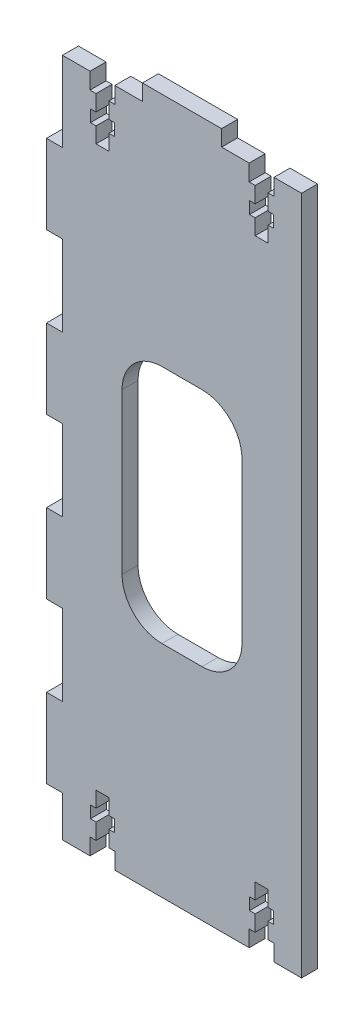
from build123d import *

# Parameters (mm, degrees)
BOSS_EXTRUDE1_DEPTH = 4
CUT_EXTRUDE1_DEPTH  = 94.973453698
SKETCH5_W           = 4
SKETCH5_H           = 19.8
BOSS_EXTRUDE2_DEPTH = 4
CUT_EXTRUDE2_DEPTH  = 96.321613499


with BuildPart() as part:
    # Sketch1 → Boss-Extrude1 (new body)
    with BuildSketch(Plane.XY):
        Polygon((-9.9, 85), (-9.9, 89), (9.9, 89), (9.9, 85), (29.9, 85), (29.9, -85), (-29.9, -85), (-29.9, 85), align=None)
    extrude(amount=BOSS_EXTRUDE1_DEPTH)

    # Sketch3 → Cut-Extrude1 (cut, through all)
    with BuildSketch(Plane(origin=(0, 0, 0), x_dir=(-1, 0, 0), z_dir=(0, 0, -1))):
        Polygon((23, 85), (23, 80.9), (21.5, 80.9), (21.5, 76.9), (22.9, 76.9), (22.9, 73.9), (21.5, 73.9), (21.5, 70), (18.3, 70), (18.3, 73.9), (16.9, 73.9), (16.9, 76.9), (18.3, 76.9), (18.3, 80.9), (16.8, 80.9), (16.8, 85), align=None)
        Polygon((-16.8, 85), (-16.8, 80.9), (-18.3, 80.9), (-18.3, 76.9), (-16.9, 76.9), (-16.9, 73.9), (-18.3, 73.9), (-18.3, 70), (-21.5, 70), (-21.5, 73.9), (-22.9, 73.9), (-22.9, 76.9), (-21.5, 76.9), (-21.5, 80.9), (-23, 80.9), (-23, 85), align=None)
        Polygon((-23, -85), (-23, -80.9), (-21.5, -80.9), (-21.5, -76.9), (-22.9, -76.9), (-22.9, -73.9), (-21.5, -73.9), (-21.5, -70), (-18.3, -70), (-18.3, -73.9), (-16.9, -73.9), (-16.9, -76.9), (-18.3, -76.9), (-18.3, -80.9), (-16.8, -80.9), (-16.8, -85), align=None)
        Polygon((16.8, -85), (16.8, -80.9), (18.3, -80.9), (18.3, -76.9), (16.9, -76.9), (16.9, -73.9), (18.3, -73.9), (18.3, -70), (21.5, -70), (21.5, -73.9), (22.9, -73.9), (22.9, -76.9), (21.5, -76.9), (21.5, -80.9), (23, -80.9), (23, -85), align=None)
    extrude(amount=-CUT_EXTRUDE1_DEPTH, mode=Mode.SUBTRACT)

    # Sketch5 → Boss-Extrude2 (add)
    with BuildSketch(Plane.XY.offset(4)):
        with Locations((-31.9, 55.1)):
            Rectangle(SKETCH5_W, SKETCH5_H)
        with Locations((-31.9, 15.1)):
            Rectangle(SKETCH5_W, SKETCH5_H)
        with Locations((-31.9, -24.9)):
            Rectangle(SKETCH5_W, SKETCH5_H)
        with Locations((-31.9, -64.9)):
            Rectangle(SKETCH5_W, SKETCH5_H)
    extrude(amount=-BOSS_EXTRUDE2_DEPTH)

    # Sketch6 → Cut-Extrude2 (cut, through all)
    with BuildSketch(Plane.XY.offset(4)):
        with BuildLine():
            Line((-5, 30), (5, 30))
            ThreePointArc((5, 30), (12.071067812, 27.071067812), (15, 20))
            Line((15, 20), (15, -20))
            ThreePointArc((15, -20), (12.071067812, -27.071067812), (5, -30))
            Line((5, -30), (-5, -30))
            ThreePointArc((-5, -30), (-12.071067812, -27.071067812), (-15, -20))
            Line((-15, -20), (-15, 20))
            ThreePointArc((-15, 20), (-12.071067812, 27.071067812), (-5, 30))
        make_face()
    extrude(amount=-CUT_EXTRUDE2_DEPTH, mode=Mode.SUBTRACT)


solid = part.part
